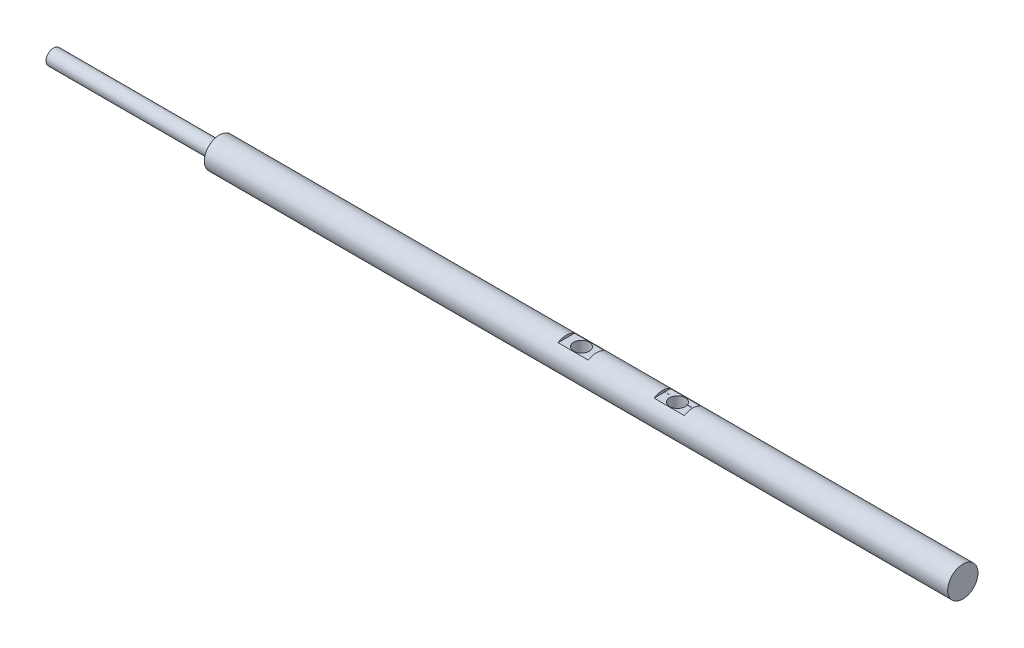
from build123d import *

# Parameters (mm, degrees)
SKETCH2_R                        = 3.175
MAIN_SHAFT_DEPTH                 = 95.25
PIN_HOLES_CUT_DEPTH              = 96.355774602
PIN_HOLES_CUT_DEPTH_BACK         = 96.355774602
SKETCH3_R                        = 1.63195
FLAT_FOR_DRILLING_CUT_DEPTH      = 96.355774709
FLAT_FOR_DRILLING_CUT_DEPTH_BACK = 96.355774709
SKETCH5_W                        = 6.35
SKETCH5_H                        = 0.508
F_1_8_CUT_DEPTH                  = 191.552909422
F_1_8_CUT_DEPTH_BACK             = 34.75482
SKETCH6_R                        = 3.175
SKETCH6_R_2                      = 1.5875


with BuildPart() as part:
    # Sketch2 → Main Shaft (new, symmetric)
    with BuildSketch(Plane(origin=(0, 0, 0), x_dir=(0, 0, -1), z_dir=(1, 0, 0))):
        Circle(SKETCH2_R)
    extrude(amount=MAIN_SHAFT_DEPTH, both=True)

    # Sketch3 → Pin Holes Cut (cut, two sides: drawn at the far end of the back side and taken through both)
    with BuildSketch(Plane(origin=(0, 0, 0), x_dir=(1, 0, 0), z_dir=(0, 1, 0)).offset(-PIN_HOLES_CUT_DEPTH_BACK)):
        with Locations(Location((15.3416, 0, 0), (0, 0, 270))):
            Circle(SKETCH3_R)
        with Locations(Location((35.4584, 0, 0), (0, 0, 270))):
            Circle(SKETCH3_R)
    extrude(amount=PIN_HOLES_CUT_DEPTH + PIN_HOLES_CUT_DEPTH_BACK, mode=Mode.SUBTRACT)

    # Sketch5 → Flat for drilling Cut (cut, two sides: drawn at the far end of the back side and taken through both)
    with BuildSketch(Plane.XY.offset(-FLAT_FOR_DRILLING_CUT_DEPTH_BACK)):
        with Locations((15.3416, 2.921)):
            Rectangle(SKETCH5_W, SKETCH5_H)
        Polygon((38.633357307, 2.666929966), (32.283357307, 2.666963572), (32.283359996, 3.174963572), (38.633359996, 3.174929966), align=None)
    extrude(amount=FLAT_FOR_DRILLING_CUT_DEPTH + FLAT_FOR_DRILLING_CUT_DEPTH_BACK, mode=Mode.SUBTRACT)

    # Sketch6 → 1/8 Cut (cut, two sides: drawn at the far end of the back side and taken through both)
    with BuildSketch(Plane.ZY.offset(95.25).offset(-F_1_8_CUT_DEPTH_BACK)):
        Circle(SKETCH6_R)
        with Locations(Location((0, 0, 0), (0, 0, 180))):
            Circle(SKETCH6_R_2, mode=Mode.SUBTRACT)
    extrude(amount=F_1_8_CUT_DEPTH + F_1_8_CUT_DEPTH_BACK, mode=Mode.SUBTRACT)


solid = part.part
